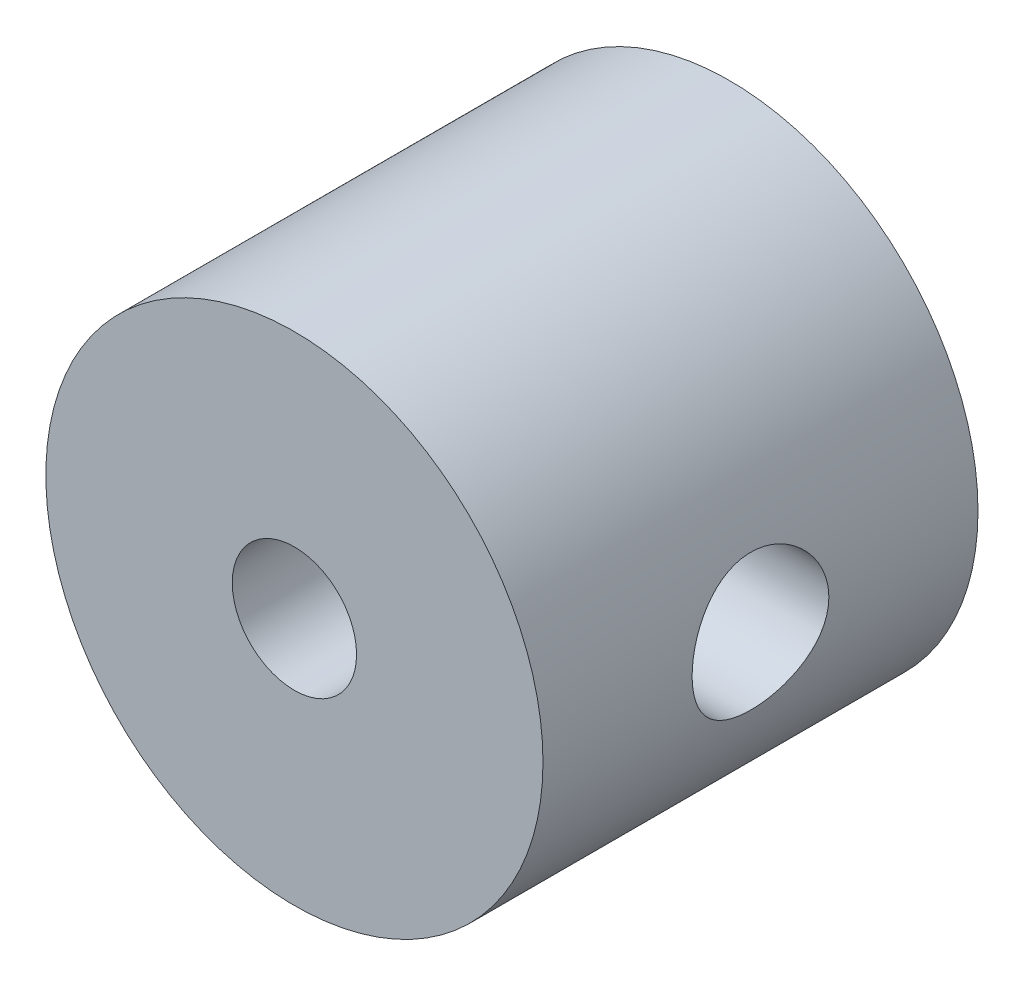
from build123d import *

# Parameters (mm, degrees)
SKETCH1_R           = 4
SKETCH1_R_2         = 1
BOSS_EXTRUDE1_DEPTH = 7
SKETCH3_R           = 1.1
CUT_EXTRUDE1_DEPTH  = 12.357816692


with BuildPart() as part:
    # Sketch1 → Boss-Extrude1 (new body)
    with BuildSketch(Plane.XY):
        Circle(SKETCH1_R)
        Circle(SKETCH1_R_2, mode=Mode.SUBTRACT)
    extrude(amount=BOSS_EXTRUDE1_DEPTH)

    # Sketch3 → Cut-Extrude1 (cut, through all)
    with BuildSketch(Plane(origin=(4, 0, 0), x_dir=(0, 0, -1), z_dir=(1, 0, 0))):
        with Locations((-3.5, 0)):
            Circle(SKETCH3_R)
    extrude(amount=-CUT_EXTRUDE1_DEPTH, mode=Mode.SUBTRACT)


solid = part.part
